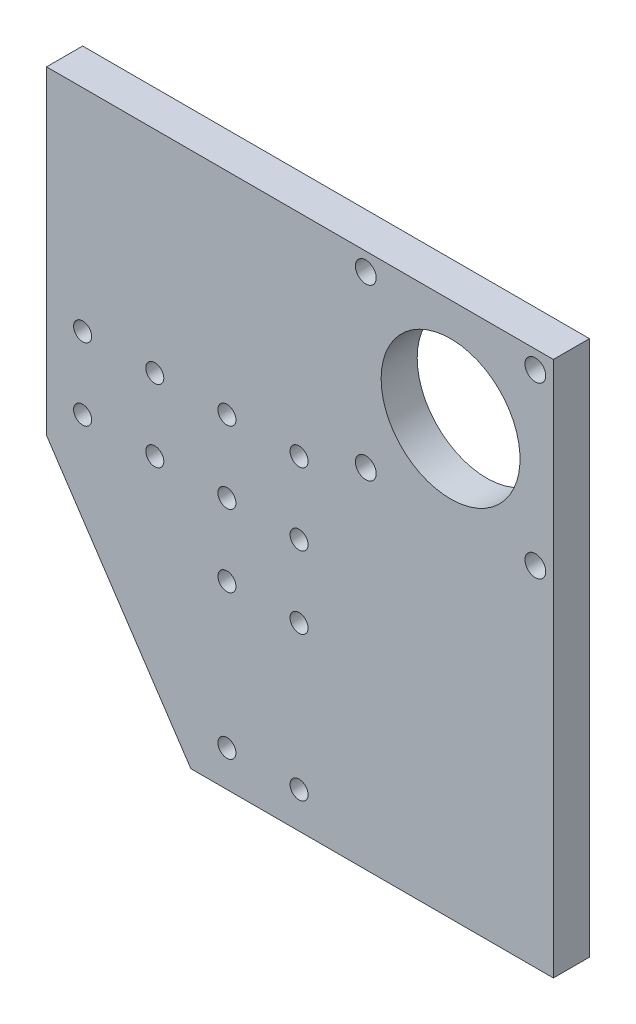
from build123d import *

# Parameters (mm, degrees)
BOSS_EXTRUDE1_DEPTH = 10
CUT_EXTRUDE1_REACH  = 181.589
SKETCH3_R           = 19.25
SKETCH3_R_2         = 2.5
SKETCH3_R_3         = 2.885000751


with BuildPart() as part:
    # Sketch1 → Boss-Extrude1 (new body)
    with BuildSketch(Plane.XY):
        Polygon((0, 0), (100.5, 0), (100.5, 148.49893218), (-40, 148.49893218), (-40, 60), align=None)
    extrude(amount=BOSS_EXTRUDE1_DEPTH)

    # Sketch3 → Cut-Extrude1 (cut, up to next)
    with BuildSketch(Plane(origin=(0, 0, 0), x_dir=(-1, 0, 0), z_dir=(0, 0, -1)), mode=Mode.PRIVATE) as cut_extrude1_sk1:
        with Locations((-72, 119.99893218)):
            Circle(SKETCH3_R)
    cut_extrude1_tool1 = extrude(cut_extrude1_sk1.sketch, amount=-CUT_EXTRUDE1_REACH, mode=Mode.PRIVATE) & part.part
    # Sketch3 → Cut-Extrude1 (cut, up to next)
    with BuildSketch(Plane(origin=(0, 0, 0), x_dir=(-1, 0, 0), z_dir=(0, 0, -1)), mode=Mode.PRIVATE) as cut_extrude1_sk2:
        with Locations((-30, 50)):
            Circle(SKETCH3_R_2)
    cut_extrude1_tool2 = extrude(cut_extrude1_sk2.sketch, amount=-CUT_EXTRUDE1_REACH, mode=Mode.PRIVATE) & part.part
    # Sketch3 → Cut-Extrude1 (cut, up to next)
    with BuildSketch(Plane(origin=(0, 0, 0), x_dir=(-1, 0, 0), z_dir=(0, 0, -1)), mode=Mode.PRIVATE) as cut_extrude1_sk3:
        with Locations((-10, 50)):
            Circle(SKETCH3_R_2)
    cut_extrude1_tool3 = extrude(cut_extrude1_sk3.sketch, amount=-CUT_EXTRUDE1_REACH, mode=Mode.PRIVATE) & part.part
    # Sketch3 → Cut-Extrude1 (cut, up to next)
    with BuildSketch(Plane(origin=(0, 0, 0), x_dir=(-1, 0, 0), z_dir=(0, 0, -1)), mode=Mode.PRIVATE) as cut_extrude1_sk4:
        with Locations((-30, 10)):
            Circle(SKETCH3_R_2)
    cut_extrude1_tool4 = extrude(cut_extrude1_sk4.sketch, amount=-CUT_EXTRUDE1_REACH, mode=Mode.PRIVATE) & part.part
    # Sketch3 → Cut-Extrude1 (cut, up to next)
    with BuildSketch(Plane(origin=(0, 0, 0), x_dir=(-1, 0, 0), z_dir=(0, 0, -1)), mode=Mode.PRIVATE) as cut_extrude1_sk5:
        with Locations((-10, 10)):
            Circle(SKETCH3_R_2)
    cut_extrude1_tool5 = extrude(cut_extrude1_sk5.sketch, amount=-CUT_EXTRUDE1_REACH, mode=Mode.PRIVATE) & part.part
    # Sketch3 → Cut-Extrude1 (cut, up to next)
    with BuildSketch(Plane(origin=(0, 0, 0), x_dir=(-1, 0, 0), z_dir=(0, 0, -1)), mode=Mode.PRIVATE) as cut_extrude1_sk6:
        with Locations((30, 70)):
            Circle(SKETCH3_R_2)
    cut_extrude1_tool6 = extrude(cut_extrude1_sk6.sketch, amount=-CUT_EXTRUDE1_REACH, mode=Mode.PRIVATE) & part.part
    # Sketch3 → Cut-Extrude1 (cut, up to next)
    with BuildSketch(Plane(origin=(0, 0, 0), x_dir=(-1, 0, 0), z_dir=(0, 0, -1)), mode=Mode.PRIVATE) as cut_extrude1_sk7:
        with Locations((30, 90)):
            Circle(SKETCH3_R_2)
    cut_extrude1_tool7 = extrude(cut_extrude1_sk7.sketch, amount=-CUT_EXTRUDE1_REACH, mode=Mode.PRIVATE) & part.part
    # Sketch3 → Cut-Extrude1 (cut, up to next)
    with BuildSketch(Plane(origin=(0, 0, 0), x_dir=(-1, 0, 0), z_dir=(0, 0, -1)), mode=Mode.PRIVATE) as cut_extrude1_sk8:
        with Locations((10, 90)):
            Circle(SKETCH3_R_2)
    cut_extrude1_tool8 = extrude(cut_extrude1_sk8.sketch, amount=-CUT_EXTRUDE1_REACH, mode=Mode.PRIVATE) & part.part
    # Sketch3 → Cut-Extrude1 (cut, up to next)
    with BuildSketch(Plane(origin=(0, 0, 0), x_dir=(-1, 0, 0), z_dir=(0, 0, -1)), mode=Mode.PRIVATE) as cut_extrude1_sk9:
        with Locations((10, 70)):
            Circle(SKETCH3_R_2)
    cut_extrude1_tool9 = extrude(cut_extrude1_sk9.sketch, amount=-CUT_EXTRUDE1_REACH, mode=Mode.PRIVATE) & part.part
    # Sketch3 → Cut-Extrude1 (cut, up to next)
    with BuildSketch(Plane(origin=(0, 0, 0), x_dir=(-1, 0, 0), z_dir=(0, 0, -1)), mode=Mode.PRIVATE) as cut_extrude1_sk10:
        with Locations((-10, 70)):
            Circle(SKETCH3_R_2)
    cut_extrude1_tool10 = extrude(cut_extrude1_sk10.sketch, amount=-CUT_EXTRUDE1_REACH, mode=Mode.PRIVATE) & part.part
    # Sketch3 → Cut-Extrude1 (cut, up to next)
    with BuildSketch(Plane(origin=(0, 0, 0), x_dir=(-1, 0, 0), z_dir=(0, 0, -1)), mode=Mode.PRIVATE) as cut_extrude1_sk11:
        with Locations((-10, 90)):
            Circle(SKETCH3_R_2)
    cut_extrude1_tool11 = extrude(cut_extrude1_sk11.sketch, amount=-CUT_EXTRUDE1_REACH, mode=Mode.PRIVATE) & part.part
    # Sketch3 → Cut-Extrude1 (cut, up to next)
    with BuildSketch(Plane(origin=(0, 0, 0), x_dir=(-1, 0, 0), z_dir=(0, 0, -1)), mode=Mode.PRIVATE) as cut_extrude1_sk12:
        with Locations((-30, 90)):
            Circle(SKETCH3_R_2)
    cut_extrude1_tool12 = extrude(cut_extrude1_sk12.sketch, amount=-CUT_EXTRUDE1_REACH, mode=Mode.PRIVATE) & part.part
    # Sketch3 → Cut-Extrude1 (cut, up to next)
    with BuildSketch(Plane(origin=(0, 0, 0), x_dir=(-1, 0, 0), z_dir=(0, 0, -1)), mode=Mode.PRIVATE) as cut_extrude1_sk13:
        with Locations((-30, 70)):
            Circle(SKETCH3_R_2)
    cut_extrude1_tool13 = extrude(cut_extrude1_sk13.sketch, amount=-CUT_EXTRUDE1_REACH, mode=Mode.PRIVATE) & part.part
    # Sketch3 → Cut-Extrude1 (cut, up to next)
    with BuildSketch(Plane(origin=(0, 0, 0), x_dir=(-1, 0, 0), z_dir=(0, 0, -1)), mode=Mode.PRIVATE) as cut_extrude1_sk14:
        with Locations((-95.5, 143.49893218)):
            Circle(SKETCH3_R_3)
    cut_extrude1_tool14 = extrude(cut_extrude1_sk14.sketch, amount=-CUT_EXTRUDE1_REACH, mode=Mode.PRIVATE) & part.part
    # Sketch3 → Cut-Extrude1 (cut, up to next)
    with BuildSketch(Plane(origin=(0, 0, 0), x_dir=(-1, 0, 0), z_dir=(0, 0, -1)), mode=Mode.PRIVATE) as cut_extrude1_sk15:
        with Locations((-48.5, 143.49893218)):
            Circle(SKETCH3_R_3)
    cut_extrude1_tool15 = extrude(cut_extrude1_sk15.sketch, amount=-CUT_EXTRUDE1_REACH, mode=Mode.PRIVATE) & part.part
    # Sketch3 → Cut-Extrude1 (cut, up to next)
    with BuildSketch(Plane(origin=(0, 0, 0), x_dir=(-1, 0, 0), z_dir=(0, 0, -1)), mode=Mode.PRIVATE) as cut_extrude1_sk16:
        with Locations((-48.5, 96.49893218)):
            Circle(SKETCH3_R_3)
    cut_extrude1_tool16 = extrude(cut_extrude1_sk16.sketch, amount=-CUT_EXTRUDE1_REACH, mode=Mode.PRIVATE) & part.part
    # Sketch3 → Cut-Extrude1 (cut, up to next)
    with BuildSketch(Plane(origin=(0, 0, 0), x_dir=(-1, 0, 0), z_dir=(0, 0, -1)), mode=Mode.PRIVATE) as cut_extrude1_sk17:
        with Locations((-95.5, 96.49893218)):
            Circle(SKETCH3_R_3)
    cut_extrude1_tool17 = extrude(cut_extrude1_sk17.sketch, amount=-CUT_EXTRUDE1_REACH, mode=Mode.PRIVATE) & part.part
    add(cut_extrude1_tool1.solids().sort_by_distance((72, 119.998932, 0))[0], mode=Mode.SUBTRACT)
    add(cut_extrude1_tool2.solids().sort_by_distance((30, 50, 0))[0], mode=Mode.SUBTRACT)
    add(cut_extrude1_tool3.solids().sort_by_distance((10, 50, 0))[0], mode=Mode.SUBTRACT)
    add(cut_extrude1_tool4.solids().sort_by_distance((30, 10, 0))[0], mode=Mode.SUBTRACT)
    add(cut_extrude1_tool5.solids().sort_by_distance((10, 10, 0))[0], mode=Mode.SUBTRACT)
    add(cut_extrude1_tool6.solids().sort_by_distance((-30, 70, 0))[0], mode=Mode.SUBTRACT)
    add(cut_extrude1_tool7.solids().sort_by_distance((-30, 90, 0))[0], mode=Mode.SUBTRACT)
    add(cut_extrude1_tool8.solids().sort_by_distance((-10, 90, 0))[0], mode=Mode.SUBTRACT)
    add(cut_extrude1_tool9.solids().sort_by_distance((-10, 70, 0))[0], mode=Mode.SUBTRACT)
    add(cut_extrude1_tool10.solids().sort_by_distance((10, 70, 0))[0], mode=Mode.SUBTRACT)
    add(cut_extrude1_tool11.solids().sort_by_distance((10, 90, 0))[0], mode=Mode.SUBTRACT)
    add(cut_extrude1_tool12.solids().sort_by_distance((30, 90, 0))[0], mode=Mode.SUBTRACT)
    add(cut_extrude1_tool13.solids().sort_by_distance((30, 70, 0))[0], mode=Mode.SUBTRACT)
    add(cut_extrude1_tool14.solids().sort_by_distance((95.5, 143.498932, 0))[0], mode=Mode.SUBTRACT)
    add(cut_extrude1_tool15.solids().sort_by_distance((48.5, 143.498932, 0))[0], mode=Mode.SUBTRACT)
    add(cut_extrude1_tool16.solids().sort_by_distance((48.5, 96.498932, 0))[0], mode=Mode.SUBTRACT)
    add(cut_extrude1_tool17.solids().sort_by_distance((95.5, 96.498932, 0))[0], mode=Mode.SUBTRACT)


solid = part.part
